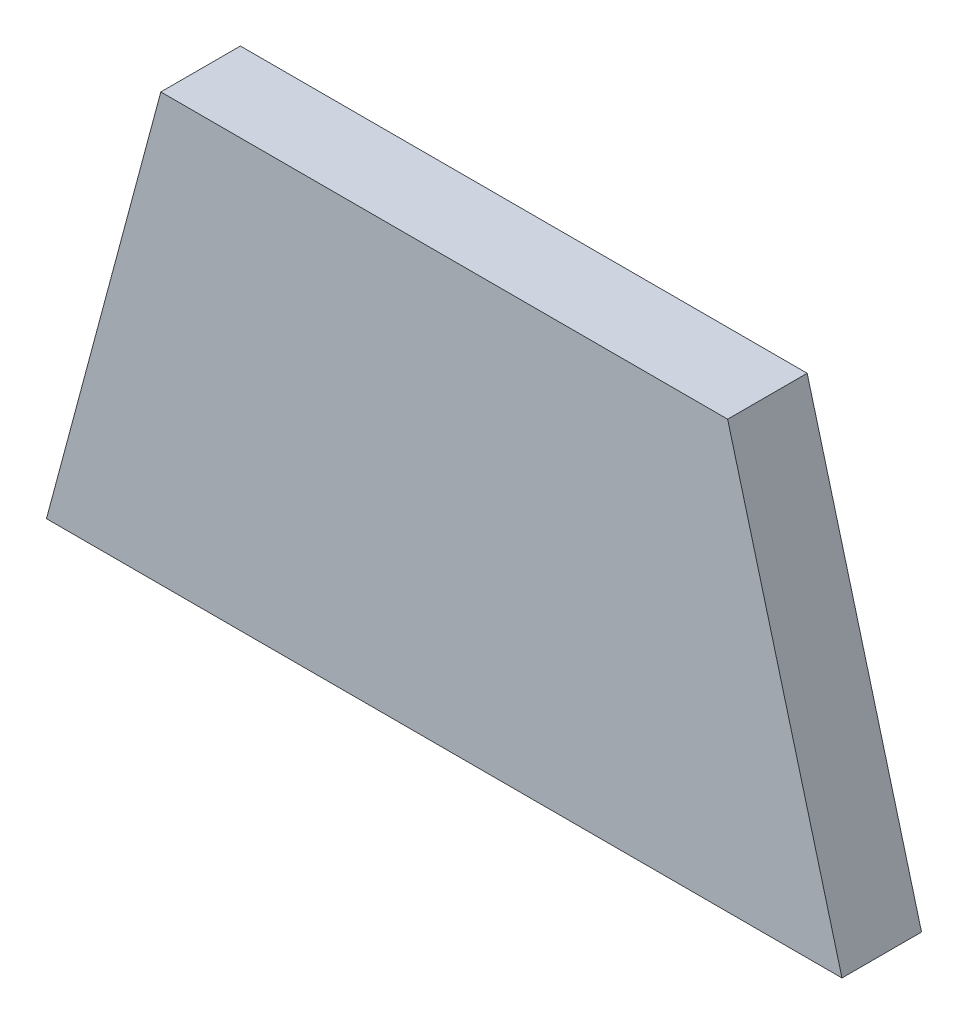
from build123d import *

# Parameters (mm, degrees)
EXTRUIR1_DEPTH = 25.4


with BuildPart() as part:
    # Croquis2 → Extruir1 (new body)
    with BuildSketch(Plane.XY):
        Polygon((90.4875, 136.266505111), (-90.4875, 136.266505111), (-127, 0), (127, 0), align=None)
    extrude(amount=EXTRUIR1_DEPTH)


solid = part.part
